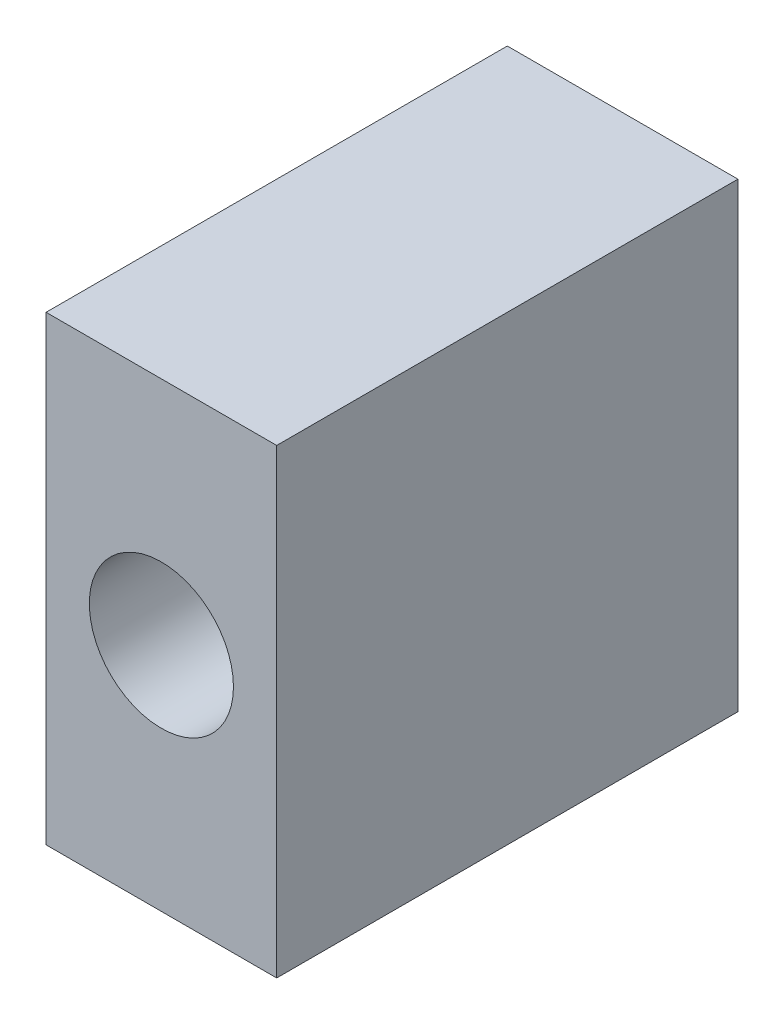
from build123d import *

# Parameters (mm, degrees)
SKETCH1_W           = 4
SKETCH1_H           = 8
SKETCH1_R           = 1.25
BOSS_EXTRUDE1_DEPTH = 8


with BuildPart() as part:
    # Sketch1 → Boss-Extrude1 (new body)
    with BuildSketch(Plane.XY):
        Rectangle(SKETCH1_W, SKETCH1_H)
        Circle(SKETCH1_R, mode=Mode.SUBTRACT)
    extrude(amount=BOSS_EXTRUDE1_DEPTH)


solid = part.part
